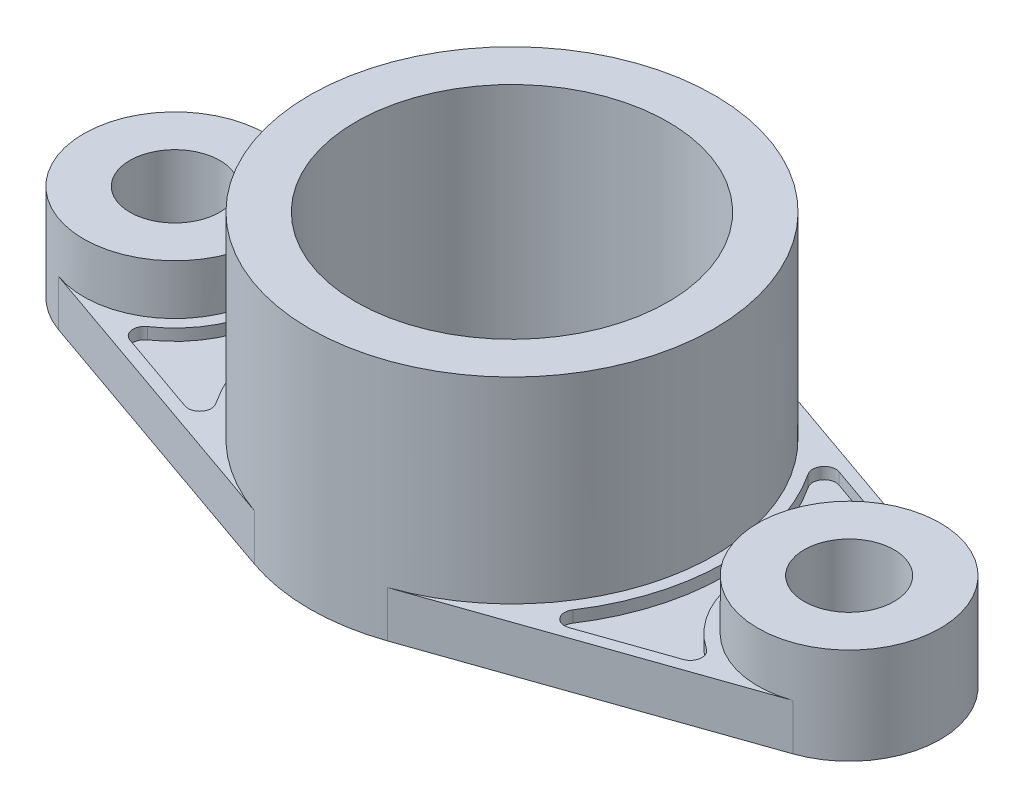
from build123d import *

# Parameters (mm, degrees)
SKETCH2_R             = 52.5
SKETCH2_R_2           = 40.5
BOSS_EXTRUDE5_DEPTH   = 63
SKETCH2_3_R           = 23.665
SKETCH2_3_R_2         = 11.665
BOSS_EXTRUDE6_DEPTH   = 25
BOSS_EXTRUDE6_2_DEPTH = 25
BOSS_EXTRUDE7_DEPTH   = 12
CUT_EXTRUDE2_DEPTH    = 3


with BuildPart() as part:
    # Sketch2 → Boss-Extrude5 (new body)
    with BuildSketch(Plane(origin=(0, 0, 0), x_dir=(1, 0, 0), z_dir=(0, 1, 0))):
        Circle(SKETCH2_R)
        Circle(SKETCH2_R_2, mode=Mode.SUBTRACT)
    extrude(amount=BOSS_EXTRUDE5_DEPTH)



with BuildPart() as body_2:
    # Sketch2<3> → Boss-Extrude6 (new body)
    with BuildSketch(Plane(origin=(0, 0, 0), x_dir=(1, 0, 0), z_dir=(0, 1, 0))):
        with Locations((-87.5, 0)):
            Circle(SKETCH2_3_R)
        with Locations((-87.5, 0)):
            Circle(SKETCH2_3_R_2, mode=Mode.SUBTRACT)
    extrude(amount=BOSS_EXTRUDE6_DEPTH)


with BuildPart() as body_3:
    # Sketch2<3> → Boss-Extrude6 2 (new body)
    with BuildSketch(Plane(origin=(0, 0, 0), x_dir=(1, 0, 0), z_dir=(0, 1, 0))):
        with Locations((87.5, 0)):
            Circle(SKETCH2_3_R)
        with Locations((87.5, 0)):
            Circle(SKETCH2_3_R_2, mode=Mode.SUBTRACT)
    extrude(amount=BOSS_EXTRUDE6_2_DEPTH)


with BuildPart() as part_1:
    add(part.part)

    add(body_2.part)  # Boss-Extrude7 merges body 2

    add(body_3.part)  # Boss-Extrude7 merges body 3
    # Sketch2<4> → Boss-Extrude7 (add)
    with BuildSketch(Plane(origin=(0, 0, 0), x_dir=(1, 0, 0), z_dir=(0, 1, 0))):
        with BuildLine():
            ThreePointArc((-95.298631714, 22.343087709), (-63.835, 0), (-95.298631714, -22.343087709))
            Line((-95.298631714, -22.343087709), (-17.301, -49.56738241))
            ThreePointArc((-17.301, -49.56738241), (-52.5, 0), (-17.301, 49.56738241))
            Line((-17.301, 49.56738241), (-95.298631714, 22.343087709))
        make_face()
        with BuildLine():
            Line((95.298631714, 22.343087709), (17.301, 49.56738241))
            ThreePointArc((17.301, 49.56738241), (52.5, 0), (17.301, -49.56738241))
            Line((17.301, -49.56738241), (95.298631714, -22.343087709))
            ThreePointArc((95.298631714, -22.343087709), (63.835, 0), (95.298631714, 22.343087709))
        make_face()
    extrude(amount=BOSS_EXTRUDE7_DEPTH)

    # Sketch6 → Cut-Extrude2 (cut)
    with BuildSketch(Plane(origin=(0, 12, 0), x_dir=(1, 0, 0), z_dir=(0, 1, 0))):
        with BuildLine():
            Line((-49.82603874, 35.037349549), (-71.809327621, 27.364302024))
            ThreePointArc((-71.809327621, 27.364302024), (-73.795133067, 24.922702734), (-72.507464694, 22.050988869))
            ThreePointArc((-72.507464694, 22.050988869), (-60.835, 0), (-72.507464694, -22.050988869))
            ThreePointArc((-72.507464694, -22.050988869), (-73.795133067, -24.922702734), (-71.809327621, -27.364302024))
            Line((-71.809327621, -27.364302024), (-49.82603874, -35.037349549))
            ThreePointArc((-49.82603874, -35.037349549), (-46.470783868, -34.048587089), (-46.332927596, -30.553392944))
            ThreePointArc((-46.332927596, -30.553392944), (-55.5, 0), (-46.332927596, 30.553392944))
            ThreePointArc((-46.332927596, 30.553392944), (-46.470783868, 34.048587089), (-49.82603874, 35.037349549))
        make_face()
    cut_extrude2 = extrude(amount=-CUT_EXTRUDE2_DEPTH, mode=Mode.SUBTRACT)

    # Mirror1: Cut-Extrude2 across plane
    add(cut_extrude2.mirror(Plane(origin=(0, 0, 0), x_dir=(0, 0, 1), z_dir=(1, 0, 0))), mode=Mode.SUBTRACT)


solid = part_1.part
